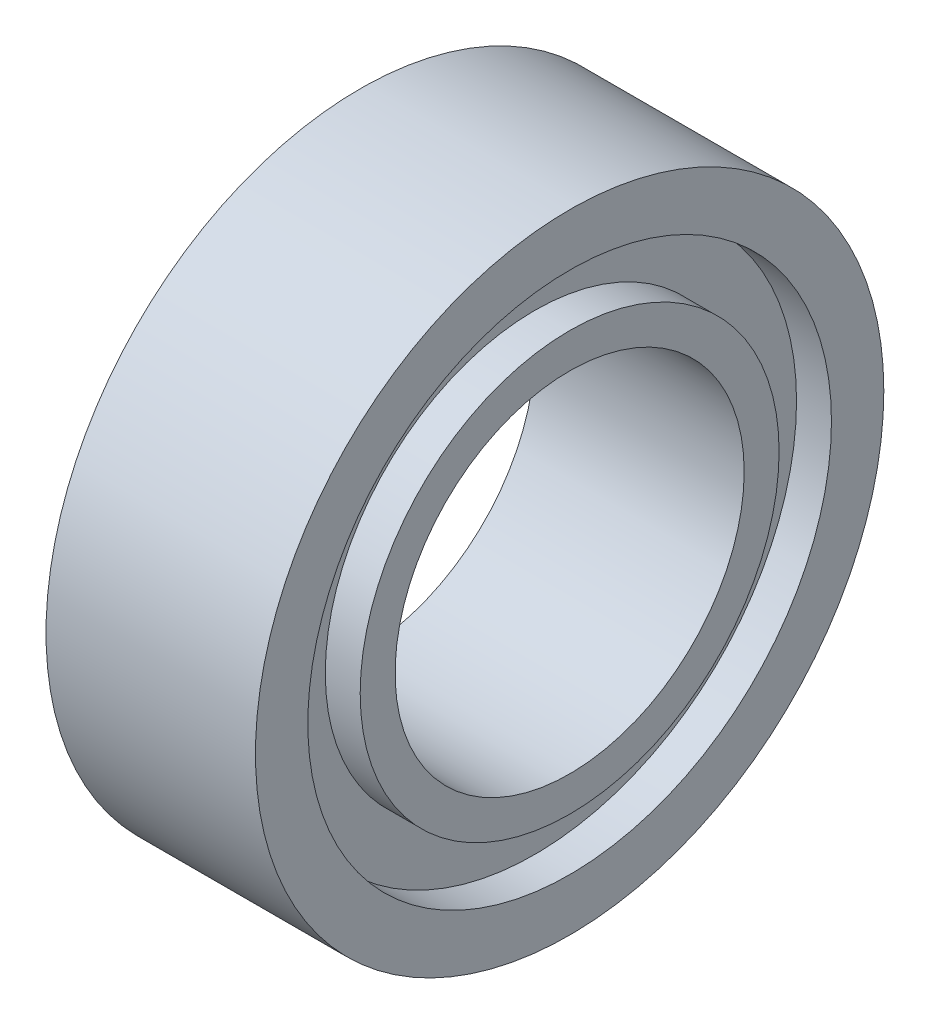
from build123d import *

# Parameters (mm, degrees)
SKETCH1_R           = 4.5
SKETCH1_R_2         = 2.5
BOSS_EXTRUDE1_DEPTH = 1.5
SKETCH2_R           = 3.75
SKETCH2_R_2         = 3
CUT_EXTRUDE1_DEPTH  = 0.5


with BuildPart() as part:
    # Sketch1 → Boss-Extrude1 (new, symmetric)
    with BuildSketch(Plane(origin=(0, 0, 0), x_dir=(0, 0, -1), z_dir=(1, 0, 0))):
        Circle(SKETCH1_R)
        Circle(SKETCH1_R_2, mode=Mode.SUBTRACT)
    extrude(amount=BOSS_EXTRUDE1_DEPTH, both=True)

    # Sketch2 → Cut-Extrude1 (cut)
    with BuildSketch(Plane(origin=(1.5, 0, 0), x_dir=(0, 0, -1), z_dir=(1, 0, 0))):
        Circle(SKETCH2_R)
        Circle(SKETCH2_R_2, mode=Mode.SUBTRACT)
    extrude(amount=-CUT_EXTRUDE1_DEPTH, mode=Mode.SUBTRACT)


solid = part.part
